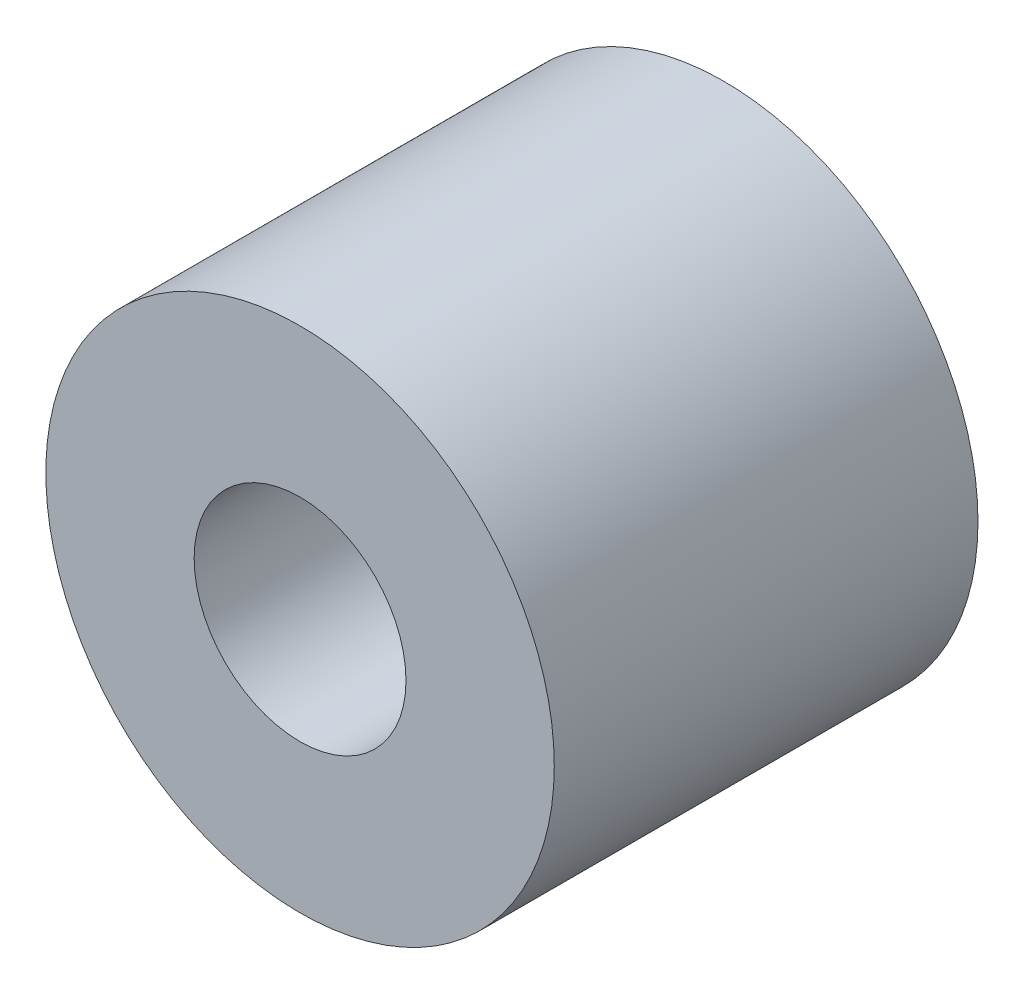
from build123d import *

# Parameters (mm, degrees)
SKETCH_1_R      = 3
SKETCH_1_R_2    = 1.25
EXTRUDE_1_DEPTH = 5


with BuildPart() as part:
    # ｽｹｯﾁ1 → ﾎﾞｽ - 押し出し1 (new body)
    with BuildSketch(Plane.XY):
        Circle(SKETCH_1_R)
        Circle(SKETCH_1_R_2, mode=Mode.SUBTRACT)
    extrude(amount=EXTRUDE_1_DEPTH)


solid = part.part
